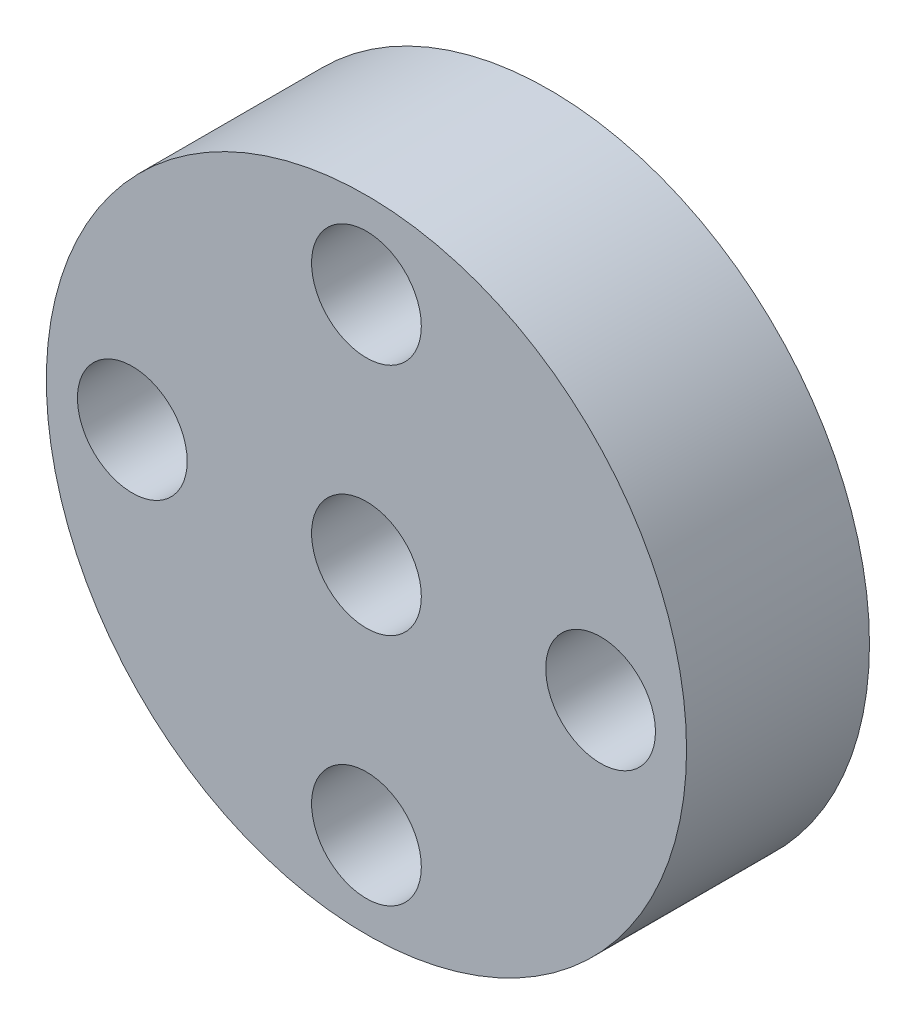
from build123d import *

# Parameters (mm, degrees)
SKETCH1_R           = 8.75
SKETCH1_R_2         = 1.5
EXTRUDE1_DEPTH      = 2.5
EXTRUDE2_DEPTH      = 13.624381173
EXTRUDE2_DEPTH_BACK = 13.624381173
SKETCH2_R           = 1.5


with BuildPart() as part:
    # Sketch1 → Extrude1 (new, symmetric)
    with BuildSketch(Plane.XY):
        Circle(SKETCH1_R)
        Circle(SKETCH1_R_2, mode=Mode.SUBTRACT)
    extrude(amount=EXTRUDE1_DEPTH, both=True)

    # Sketch2 → Extrude2 (cut, two sides: drawn at the far end of the back side and taken through both)
    with BuildSketch(Plane.XY.offset(-EXTRUDE2_DEPTH_BACK)):
        with Locations((0, 6.4)):
            Circle(SKETCH2_R)
        with Locations((6.4, 0)):
            Circle(SKETCH2_R)
        with Locations((0, -6.4)):
            Circle(SKETCH2_R)
        with Locations((-6.4, 0)):
            Circle(SKETCH2_R)
    extrude(amount=EXTRUDE2_DEPTH + EXTRUDE2_DEPTH_BACK, mode=Mode.SUBTRACT)


solid = part.part
